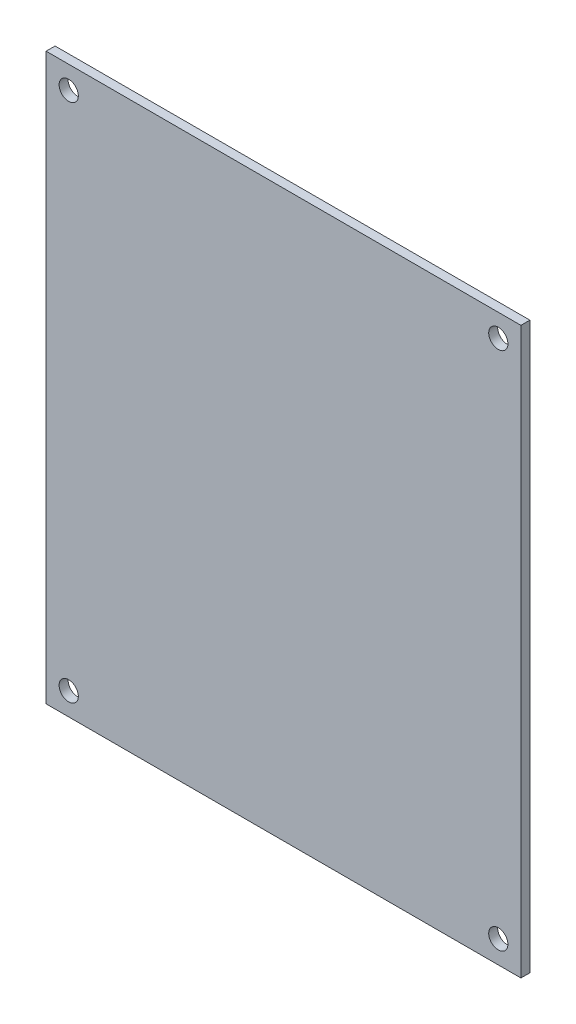
from build123d import *

# Parameters (mm, degrees)
SKETCH1_W           = 1.5875
SKETCH1_H           = 99.999999898
BOSS_EXTRUDE1_DEPTH = 41.999999947
SKETCH2_R           = 1.700000029
CUT_EXTRUDE1_DEPTH  = 66.318604905


with BuildPart() as part:
    # Sketch1 → Boss-Extrude1 (new, symmetric)
    with BuildSketch(Plane(origin=(0, 0, 0), x_dir=(0, 0, -1), z_dir=(1, 0, 0))):
        Rectangle(SKETCH1_W, SKETCH1_H)
    extrude(amount=BOSS_EXTRUDE1_DEPTH, both=True)

    # Sketch2 → Cut-Extrude1 (cut, through all)
    with BuildSketch(Plane.XY.offset(0.79375)):
        with Locations((-37.999999819, 45.999999821)):
            Circle(SKETCH2_R)
        with Locations((37.999999819, 45.999999821)):
            Circle(SKETCH2_R)
        with Locations((37.999999819, -45.999999821)):
            Circle(SKETCH2_R)
        with Locations((-37.999999819, -45.999999821)):
            Circle(SKETCH2_R)
    extrude(amount=-CUT_EXTRUDE1_DEPTH, mode=Mode.SUBTRACT)


solid = part.part
